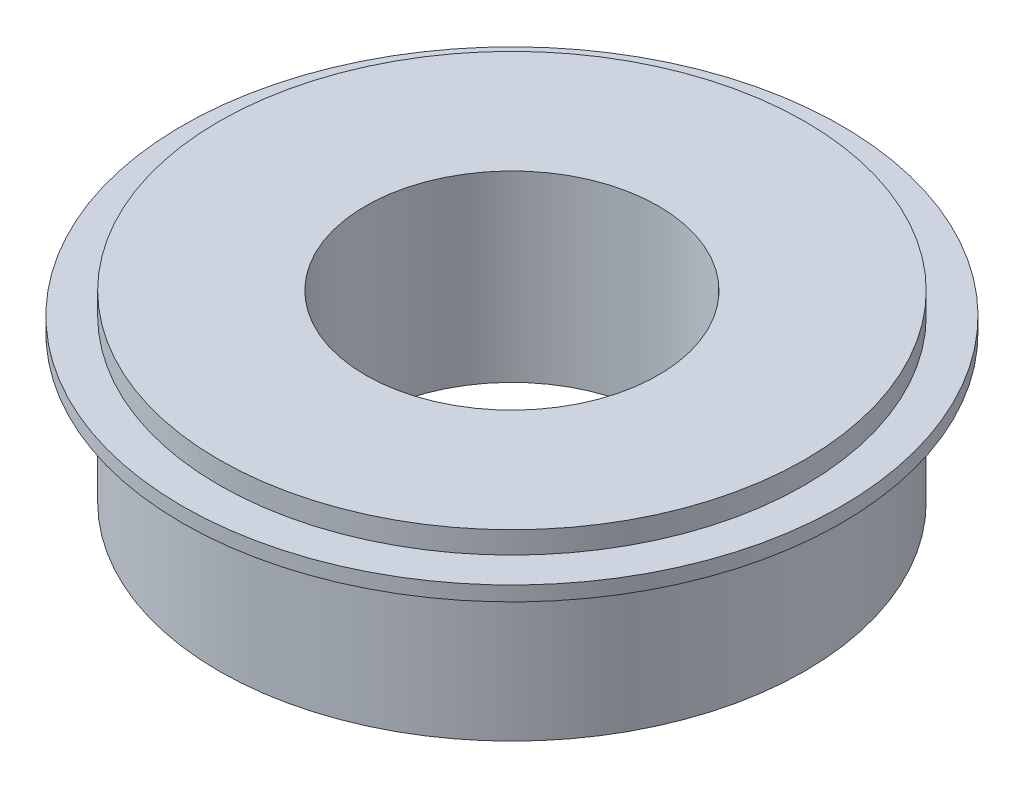
from build123d import *

# Parameters (mm, degrees)
SKETCH1_R           = 8
SKETCH1_R_2         = 4
BOSS_EXTRUDE1_DEPTH = 5
BOSS_EXTRUDE2_START = -1
SKETCH2_R           = 9
SKETCH2_R_2         = 8
BOSS_EXTRUDE2_DEPTH = 0.4


with BuildPart() as part:
    # Sketch1 → Boss-Extrude1 (new body)
    with BuildSketch(Plane(origin=(0, 0, 0), x_dir=(1, 0, 0), z_dir=(0, 1, 0))):
        with Locations(Location((0, 0, 0), (0, 0, 270))):
            Circle(SKETCH1_R)
        with Locations(Location((0, 0, 0), (0, 0, 270))):
            Circle(SKETCH1_R_2, mode=Mode.SUBTRACT)
    extrude(amount=BOSS_EXTRUDE1_DEPTH)

    # Sketch2 → Boss-Extrude2 (add)
    with BuildSketch(Plane(origin=(0, 5, 0), x_dir=(1, 0, 0), z_dir=(0, 1, 0)).offset(BOSS_EXTRUDE2_START)):
        with Locations(Location((0, 0, 0), (0, 0, 270))):
            Circle(SKETCH2_R)
        with Locations(Location((0, 0, 0), (0, 0, 270))):
            Circle(SKETCH2_R_2, mode=Mode.SUBTRACT)
    extrude(amount=BOSS_EXTRUDE2_DEPTH)


solid = part.part
